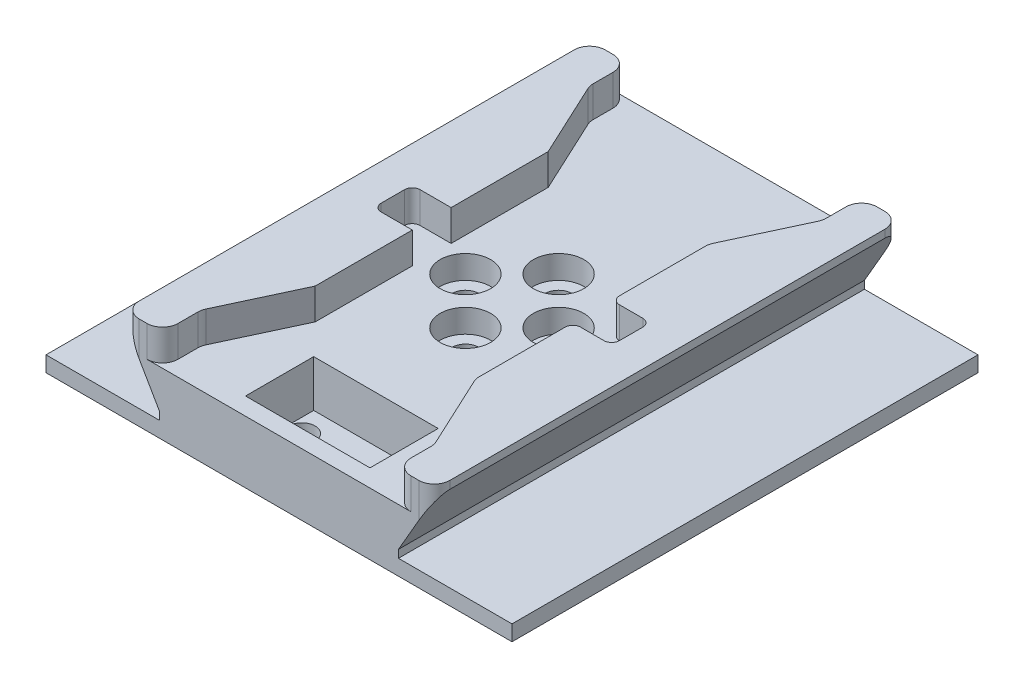
from build123d import *

# Parameters (mm, degrees)
EXTRUDE_1_DEPTH             = 60
CUT_EXTRUDE_1_DEPTH         = 4
SKETCH_3_W                  = 5
SKETCH_3_H                  = 5
CUT_EXTRUDE_2_DEPTH         = 4
FILLET_1_R                  = 2
FILLET_2_R                  = 1
HOLE_WIZARD_M31_D           = 3.4
HOLE_WIZARD_M31_CBORE_D     = 6.5
HOLE_WIZARD_M31_CBORE_DEPTH = 3
SKETCH_9_W                  = 16.027024291
SKETCH_9_H                  = 8.780763308
CUT_EXTRUDE_4_DEPTH         = 6
SKETCH_10_R                 = 1.700955844
CUT_EXTRUDE_5_DEPTH         = 68.823299831


with BuildPart() as part:
    # Эскиз1 → Бобышка-Вытянуть1 (new body)
    with BuildSketch(Plane.XY):
        Polygon((-20, 5), (-15.381197846, -3), (-15.381197846, -4), (-30, -4), (-30, -6), (30, -6), (30, -4), (15.381197846, -4), (15.381197846, -3), (20, 5), (20, 6), (-20, 6), align=None)
    extrude(amount=EXTRUDE_1_DEPTH)

    # Эскиз2 → Вырез-Вытянуть1 (cut)
    with BuildSketch(Plane(origin=(0, 6, 0), x_dir=(1, 0, 0), z_dir=(0, 1, 0))):
        Polygon((15, 0), (-15, 0), (-15, -5), (-10.336923418, -15), (-10.336923418, -45), (-15, -55), (-15, -60), (15, -60), (15, -55), (10.336923418, -45), (10.336923418, -15), (15, -5), align=None)
    extrude(amount=-CUT_EXTRUDE_1_DEPTH, mode=Mode.SUBTRACT)

    # Эскиз3 → Вырез-Вытянуть2 (cut)
    with BuildSketch(Plane(origin=(0, 6, 0), x_dir=(1, 0, 0), z_dir=(0, 1, 0))):
        with Locations((-12.836923418, -30)):
            Rectangle(SKETCH_3_W, SKETCH_3_H)
        with Locations((12.836923418, -30)):
            Rectangle(SKETCH_3_W, SKETCH_3_H)
    extrude(amount=-CUT_EXTRUDE_2_DEPTH, mode=Mode.SUBTRACT)

    # Скругление1
    fillet_1_edges = [part.edges().sort_by_distance(p)[0] for p in [
        (20, 5.5, 0),
        (-20, 5.5, 0),
        (20, 5.5, 60),
        (-20, 5.5, 60),
        (-15, 4, 5),
        (-15, 4, 0),
        (15, 4, 0),
        (15, 4, 5),
        (10.336923418, 4, 15),
        (10.336923418, 4, 45),
        (15, 4, 55),
        (15, 4, 60),
        (-15, 4, 60),
        (-15, 4, 55),
    ]]
    fillet(fillet_1_edges, radius=FILLET_1_R)

    # Скругление2
    fillet_2_edges = [part.edges().sort_by_distance(p)[0] for p in [
        (-15.336923418, 4, 32.5),
        (-15.336923418, 4, 27.5),
        (10.336923418, 4, 27.5),
        (15.336923418, 4, 27.5),
        (15.336923418, 4, 32.5),
        (10.336923418, 4, 32.5),
    ]]
    fillet(fillet_2_edges, radius=FILLET_2_R)

    # Цековка для винта с внутренним шестигранником M31 (through all)
    with Locations(Plane(origin=(0, 2, 0), x_dir=(1, 0, 0), z_dir=(0, 1, 0))):
        with Locations((0, -24), (6, -30), (0, -36), (-6, -30)):
            CounterBoreHole(HOLE_WIZARD_M31_D / 2, HOLE_WIZARD_M31_CBORE_D / 2, HOLE_WIZARD_M31_CBORE_DEPTH)

    # Эскиз9 → Вырез-Вытянуть4 (cut)
    with BuildSketch(Plane(origin=(0, 2, 0), x_dir=(1, 0, 0), z_dir=(0, 1, 0))):
        with Locations((1.449252196, -53.358535403)):
            Rectangle(SKETCH_9_W, SKETCH_9_H)
    extrude(amount=-CUT_EXTRUDE_4_DEPTH, mode=Mode.SUBTRACT)

    # Эскиз10 → Вырез-Вытянуть5 (cut, through all)
    with BuildSketch(Plane(origin=(0, -4, 0), x_dir=(1, 0, 0), z_dir=(0, 1, 0))):
        with Locations(Location((-4.749733233, -52.305802454, 0), (0, 0, 180))):
            Circle(SKETCH_10_R)
    extrude(amount=-CUT_EXTRUDE_5_DEPTH, mode=Mode.SUBTRACT)


solid = part.part
